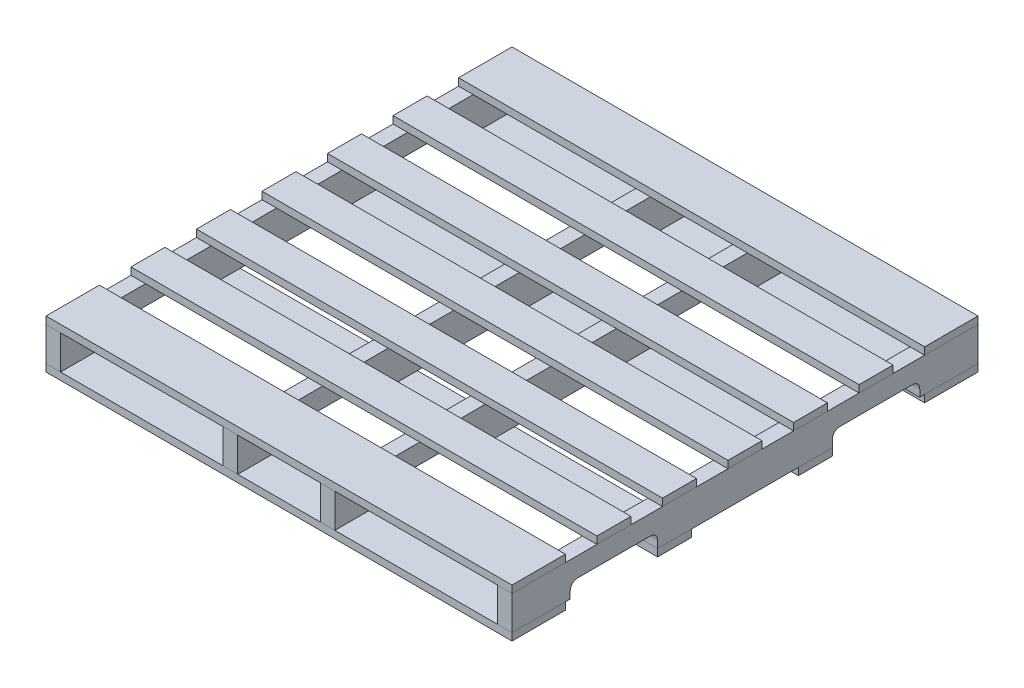
from build123d import *

# Parameters (mm, degrees)
BOSS_EXTRUDE1_DEPTH        = 609.6
BOSS_EXTRUDE1_DEPTH_BACK   = 609.6
SKETCH3_W                  = 38.1
SKETCH3_H                  = 88.9
BOSS_EXTRUDE1_2_DEPTH      = 609.6
BOSS_EXTRUDE1_2_DEPTH_BACK = 609.6
BOSS_EXTRUDE1_3_DEPTH      = 609.6
BOSS_EXTRUDE1_3_DEPTH_BACK = 609.6
BOSS_EXTRUDE1_4_DEPTH      = 609.6
BOSS_EXTRUDE1_4_DEPTH_BACK = 609.6
SKETCH4_W                  = 1219.2
SKETCH4_H                  = 139.7
BOSS_EXTRUDE2_DEPTH        = 19.05
BOSS_EXTRUDE2_2_DEPTH      = 19.05
SKETCH4_H_2                = 88.9
BOSS_EXTRUDE2_3_DEPTH      = 19.05
BOSS_EXTRUDE2_4_DEPTH      = 19.05
BOSS_EXTRUDE2_5_DEPTH      = 19.05
BOSS_EXTRUDE2_6_DEPTH      = 19.05
BOSS_EXTRUDE2_7_DEPTH      = 19.05
SKETCH5_W                  = 1219.2
SKETCH5_H                  = 139.7
BOSS_EXTRUDE3_DEPTH        = 19.05
BOSS_EXTRUDE3_2_DEPTH      = 19.05
SKETCH5_H_2                = 88.9
BOSS_EXTRUDE3_3_DEPTH      = 19.05
BOSS_EXTRUDE3_4_DEPTH      = 19.05
CUT_EXTRUDE2_DEPTH         = 1365.585303306
CUT_EXTRUDE2_DEPTH_BACK    = 1365.585303306


with BuildPart() as part:
    # Sketch3 → Boss-Extrude1 (new, two sides: drawn at the far end of the back side and taken through both)
    with BuildSketch(Plane.XY.offset(-BOSS_EXTRUDE1_DEPTH_BACK)):
        with Locations((-590.55, 0)):
            Rectangle(SKETCH3_W, SKETCH3_H)
    extrude(amount=BOSS_EXTRUDE1_DEPTH + BOSS_EXTRUDE1_DEPTH_BACK)


with BuildPart() as body_2:
    # Sketch3 → Boss-Extrude1 2 (new, two sides: drawn at the far end of the back side and taken through both)
    with BuildSketch(Plane.XY.offset(-BOSS_EXTRUDE1_2_DEPTH_BACK)):
        with Locations((127, 0)):
            Rectangle(SKETCH3_W, SKETCH3_H)
    extrude(amount=BOSS_EXTRUDE1_2_DEPTH + BOSS_EXTRUDE1_2_DEPTH_BACK)


with BuildPart() as body_3:
    # Sketch3 → Boss-Extrude1 3 (new, two sides: drawn at the far end of the back side and taken through both)
    with BuildSketch(Plane.XY.offset(-BOSS_EXTRUDE1_3_DEPTH_BACK)):
        with Locations((590.55, 0)):
            Rectangle(SKETCH3_W, SKETCH3_H)
    extrude(amount=BOSS_EXTRUDE1_3_DEPTH + BOSS_EXTRUDE1_3_DEPTH_BACK)


with BuildPart() as body_4:
    # Sketch3 → Boss-Extrude1 4 (new, two sides: drawn at the far end of the back side and taken through both)
    with BuildSketch(Plane.XY.offset(-BOSS_EXTRUDE1_4_DEPTH_BACK)):
        with Locations((-127, 0)):
            Rectangle(SKETCH3_W, SKETCH3_H)
    extrude(amount=BOSS_EXTRUDE1_4_DEPTH + BOSS_EXTRUDE1_4_DEPTH_BACK)


with BuildPart() as body_5:
    # Sketch4 → Boss-Extrude2 (new body)
    with BuildSketch(Plane(origin=(0, 44.45, 0), x_dir=(1, 0, 0), z_dir=(0, 1, 0))):
        with Locations((0, -539.75)):
            Rectangle(SKETCH4_W, SKETCH4_H)
    extrude(amount=BOSS_EXTRUDE2_DEPTH)


with BuildPart() as body_6:
    # Sketch4 → Boss-Extrude2 2 (new body)
    with BuildSketch(Plane(origin=(0, 44.45, 0), x_dir=(1, 0, 0), z_dir=(0, 1, 0))):
        with Locations((0, 539.75)):
            Rectangle(SKETCH4_W, SKETCH4_H)
    extrude(amount=BOSS_EXTRUDE2_2_DEPTH)


with BuildPart() as body_7:
    # Sketch4 → Boss-Extrude2 3 (new body)
    with BuildSketch(Plane(origin=(0, 44.45, 0), x_dir=(1, 0, 0), z_dir=(0, 1, 0))):
        with Locations((0, -342.9)):
            Rectangle(SKETCH4_W, SKETCH4_H_2)
    extrude(amount=BOSS_EXTRUDE2_3_DEPTH)


with BuildPart() as body_8:
    # Sketch4 → Boss-Extrude2 4 (new body)
    with BuildSketch(Plane(origin=(0, 44.45, 0), x_dir=(1, 0, 0), z_dir=(0, 1, 0))):
        with Locations((0, -171.45)):
            Rectangle(SKETCH4_W, SKETCH4_H_2)
    extrude(amount=BOSS_EXTRUDE2_4_DEPTH)


with BuildPart() as body_9:
    # Sketch4 → Boss-Extrude2 5 (new body)
    with BuildSketch(Plane(origin=(0, 44.45, 0), x_dir=(1, 0, 0), z_dir=(0, 1, 0))):
        with Locations((0, 342.9)):
            Rectangle(SKETCH4_W, SKETCH4_H_2)
    extrude(amount=BOSS_EXTRUDE2_5_DEPTH)


with BuildPart() as body_10:
    # Sketch4 → Boss-Extrude2 6 (new body)
    with BuildSketch(Plane(origin=(0, 44.45, 0), x_dir=(1, 0, 0), z_dir=(0, 1, 0))):
        with Locations((0, 171.45)):
            Rectangle(SKETCH4_W, SKETCH4_H_2)
    extrude(amount=BOSS_EXTRUDE2_6_DEPTH)


with BuildPart() as body_11:
    # Sketch4 → Boss-Extrude2 7 (new body)
    with BuildSketch(Plane(origin=(0, 44.45, 0), x_dir=(1, 0, 0), z_dir=(0, 1, 0))):
        Rectangle(SKETCH4_W, SKETCH4_H_2)
    extrude(amount=BOSS_EXTRUDE2_7_DEPTH)


with BuildPart() as body_12:
    # Sketch5 → Boss-Extrude3 (new body)
    with BuildSketch(Plane.XZ.offset(44.45)):
        with Locations((0, 539.75)):
            Rectangle(SKETCH5_W, SKETCH5_H)
    extrude(amount=BOSS_EXTRUDE3_DEPTH)


with BuildPart() as body_13:
    # Sketch5 → Boss-Extrude3 2 (new body)
    with BuildSketch(Plane.XZ.offset(44.45)):
        with Locations((0, -539.75)):
            Rectangle(SKETCH5_W, SKETCH5_H)
    extrude(amount=BOSS_EXTRUDE3_2_DEPTH)


with BuildPart() as body_14:
    # Sketch5 → Boss-Extrude3 3 (new body)
    with BuildSketch(Plane.XZ.offset(44.45)):
        with Locations((0, 184.15)):
            Rectangle(SKETCH5_W, SKETCH5_H_2)
    extrude(amount=BOSS_EXTRUDE3_3_DEPTH)


with BuildPart() as body_15:
    # Sketch5 → Boss-Extrude3 4 (new body)
    with BuildSketch(Plane.XZ.offset(44.45)):
        with Locations((0, -184.15)):
            Rectangle(SKETCH5_W, SKETCH5_H_2)
    extrude(amount=BOSS_EXTRUDE3_4_DEPTH)


with BuildPart() as cut_extrude2_tool:
    # Sketch8 → Cut-Extrude2 (new, two sides: drawn at the far end of the back side and taken through both)
    with BuildSketch(Plane(origin=(609.6, 0, 0), x_dir=(0, 0, -1), z_dir=(1, 0, 0)).offset(-CUT_EXTRUDE2_DEPTH_BACK)):
        with BuildLine():
            Line((-228.6, -44.45), (-457.2, -44.45))
            Line((-457.2, -44.45), (-457.2, -25.4))
            ThreePointArc((-457.2, -25.4), (-451.620384182, -11.929615818), (-438.15, -6.35))
            Line((-438.15, -6.35), (-247.65, -6.35))
            ThreePointArc((-247.65, -6.35), (-234.179615818, -11.929615818), (-228.6, -25.4))
            Line((-228.6, -25.4), (-228.6, -44.45))
        make_face()
        with BuildLine():
            Line((228.6, -44.45), (457.2, -44.45))
            Line((457.2, -44.45), (457.2, -25.4))
            ThreePointArc((457.2, -25.4), (451.620384182, -11.929615818), (438.15, -6.35))
            Line((438.15, -6.35), (247.65, -6.35))
            ThreePointArc((247.65, -6.35), (234.179615818, -11.929615818), (228.6, -25.4))
            Line((228.6, -25.4), (228.6, -44.45))
        make_face()
    extrude(amount=CUT_EXTRUDE2_DEPTH + CUT_EXTRUDE2_DEPTH_BACK)


with BuildPart() as part_1:
    add(part.part)

    # Cut-Extrude2: cut by cut_extrude2_tool
    add(cut_extrude2_tool.part, mode=Mode.SUBTRACT)


with BuildPart() as body_2_1:
    add(body_2.part)

    # Cut-Extrude2: cut by cut_extrude2_tool
    add(cut_extrude2_tool.part, mode=Mode.SUBTRACT)


with BuildPart() as body_3_1:
    add(body_3.part)

    # Cut-Extrude2: cut by cut_extrude2_tool
    add(cut_extrude2_tool.part, mode=Mode.SUBTRACT)


with BuildPart() as body_4_1:
    add(body_4.part)

    # Cut-Extrude2: cut by cut_extrude2_tool
    add(cut_extrude2_tool.part, mode=Mode.SUBTRACT)


solid = Compound([body_5.part, body_6.part, body_7.part, body_8.part, body_9.part, body_10.part, body_11.part, body_12.part, body_13.part, body_14.part, body_15.part, part_1.part, body_2_1.part, body_3_1.part, body_4_1.part])
